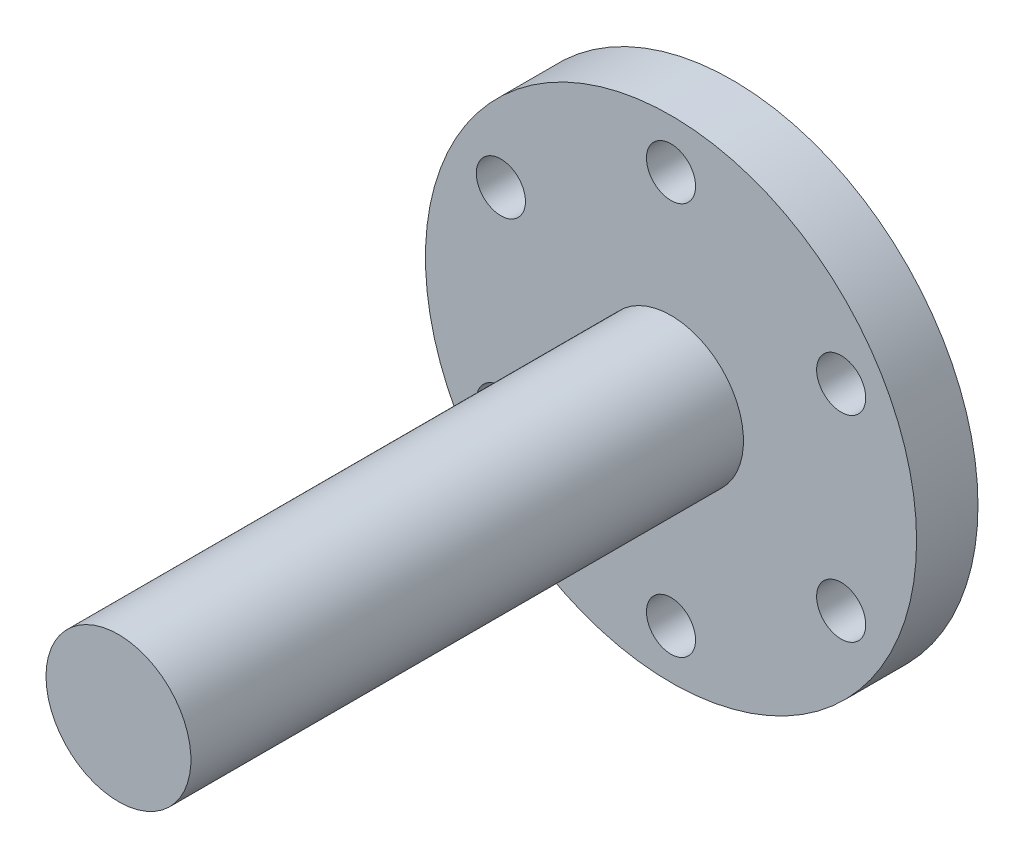
from build123d import *

# Parameters (mm, degrees)
SKETCH1_R           = 20
BOSS_EXTRUDE1_DEPTH = 5
SKETCH2_R           = 5.9
BOSS_EXTRUDE2_DEPTH = 45
SKETCH3_R           = 2
CUT_EXTRUDE1_DEPTH  = 5


with BuildPart() as part:
    # Sketch1 → Boss-Extrude1 (new body)
    with BuildSketch(Plane.XY):
        Circle(SKETCH1_R)
    extrude(amount=BOSS_EXTRUDE1_DEPTH)

    # Sketch2 → Boss-Extrude2 (add)
    with BuildSketch(Plane.XY.offset(5)):
        with Locations(Location((0, 0, 0), (0, 0, 180))):
            Circle(SKETCH2_R)
    extrude(amount=BOSS_EXTRUDE2_DEPTH)

    # Sketch3 → Cut-Extrude1 (cut)
    with BuildSketch(Plane.XY.offset(5)):
        with Locations((0, 16)):
            Circle(SKETCH3_R)
        with Locations((13.856406461, 8)):
            Circle(SKETCH3_R)
        with Locations((13.856406461, -8)):
            Circle(SKETCH3_R)
        with Locations((0, -16)):
            Circle(SKETCH3_R)
        with Locations((-13.856406461, -8)):
            Circle(SKETCH3_R)
        with Locations((-13.856406461, 8)):
            Circle(SKETCH3_R)
    extrude(amount=-CUT_EXTRUDE1_DEPTH, mode=Mode.SUBTRACT)


solid = part.part
